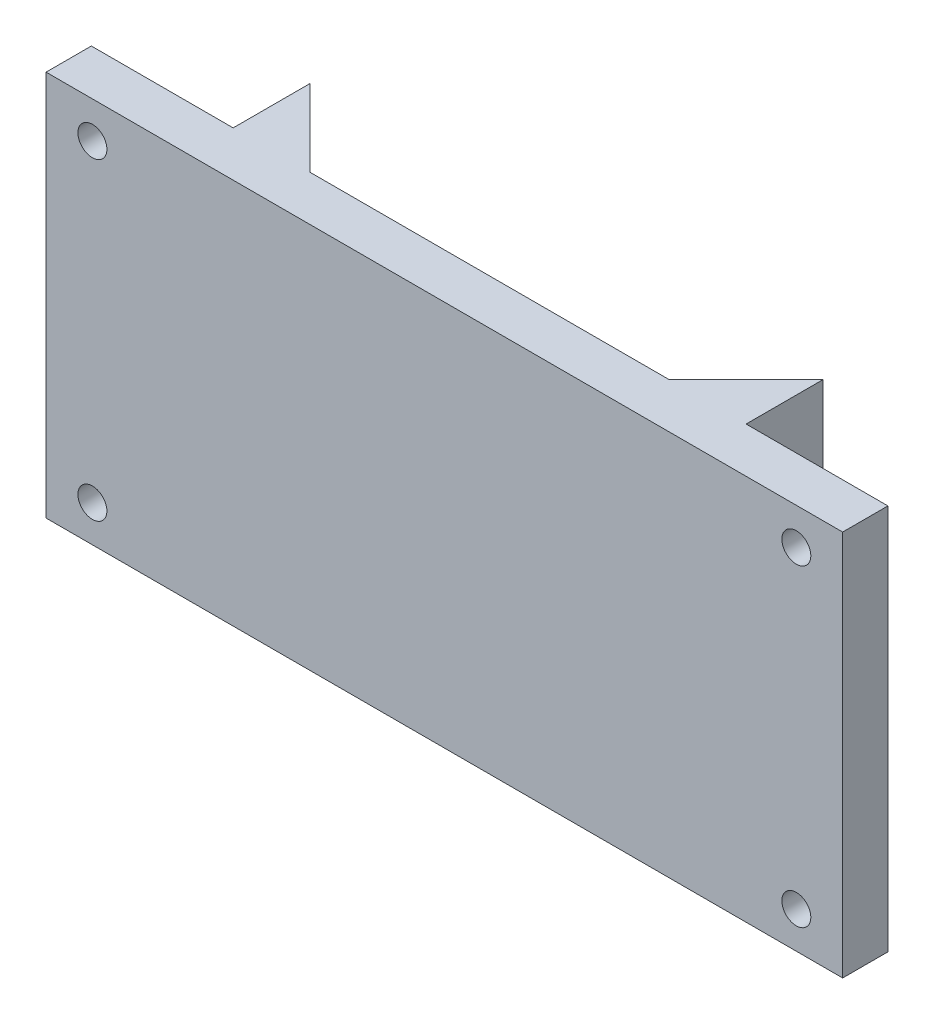
from build123d import *

# Parameters (mm, degrees)
SKETCH1_W            = 50
SKETCH1_H            = 32
BOSS_EXTRUDE1_DEPTH  = 3.75
BOSS_EXTRUDE2_DEPTH  = 32
SKETCH4_W            = 8
SKETCH4_H            = 3.75
BOSS_EXTRUDE3_DEPTH  = 32
M2_CLEARANCE_HOLE1_D = 2.4


with BuildPart() as part:
    # Sketch1 → Boss-Extrude1 (new body)
    with BuildSketch(Plane.XY):
        Rectangle(SKETCH1_W, SKETCH1_H)
    extrude(amount=BOSS_EXTRUDE1_DEPTH)

    # Sketch2 → Boss-Extrude2 (add)
    with BuildSketch(Plane(origin=(0, 16, 0), x_dir=(1, 0, 0), z_dir=(0, 1, 0))):
        Polygon((-21.25, 0), (-21.25, 6.363961031), (-14.886038969, 0), align=None)
        Polygon((14.886038969, 0), (21.25, 0), (21.25, 6.363961031), align=None)
    extrude(amount=-BOSS_EXTRUDE2_DEPTH)

    # Sketch4 → Boss-Extrude3 (add)
    with BuildSketch(Plane(origin=(0, 16, 0), x_dir=(1, 0, 0), z_dir=(0, 1, 0))):
        with Locations((29, -1.875)):
            Rectangle(SKETCH4_W, SKETCH4_H)
        with Locations((-29, -1.875)):
            Rectangle(SKETCH4_W, SKETCH4_H)
    extrude(amount=-BOSS_EXTRUDE3_DEPTH)

    # M2 Clearance Hole1 (through all)
    with Locations(Plane.XY.offset(3.75)):
        with Locations((-29.16173141, -12.975), (-29.16173141, 12.975)):
            m2_clearance_hole1 = Hole(M2_CLEARANCE_HOLE1_D / 2)

    # Mirror1: M2 Clearance Hole1 across plane
    add(m2_clearance_hole1.mirror(Plane(origin=(0, 0, 0), x_dir=(0, 0, 1), z_dir=(1, 0, 0))), mode=Mode.SUBTRACT)


solid = part.part
